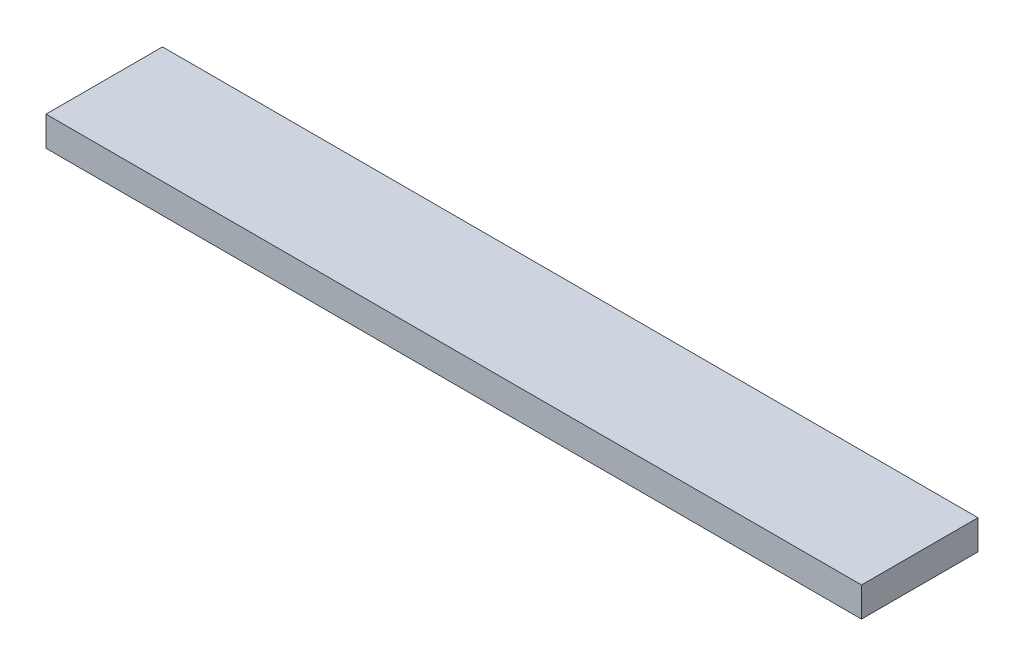
from build123d import *

# Parameters (mm, degrees)
ESQUISSE1_W        = 175
ESQUISSE1_H        = 25
BOSS_EXTRU_1_DEPTH = 6.35


with BuildPart() as part:
    # Esquisse1 → Boss.-Extru.1 (new body)
    with BuildSketch(Plane(origin=(0, 0, 0), x_dir=(1, 0, 0), z_dir=(0, 1, 0))):
        Rectangle(ESQUISSE1_W, ESQUISSE1_H)
    extrude(amount=BOSS_EXTRU_1_DEPTH)


solid = part.part
